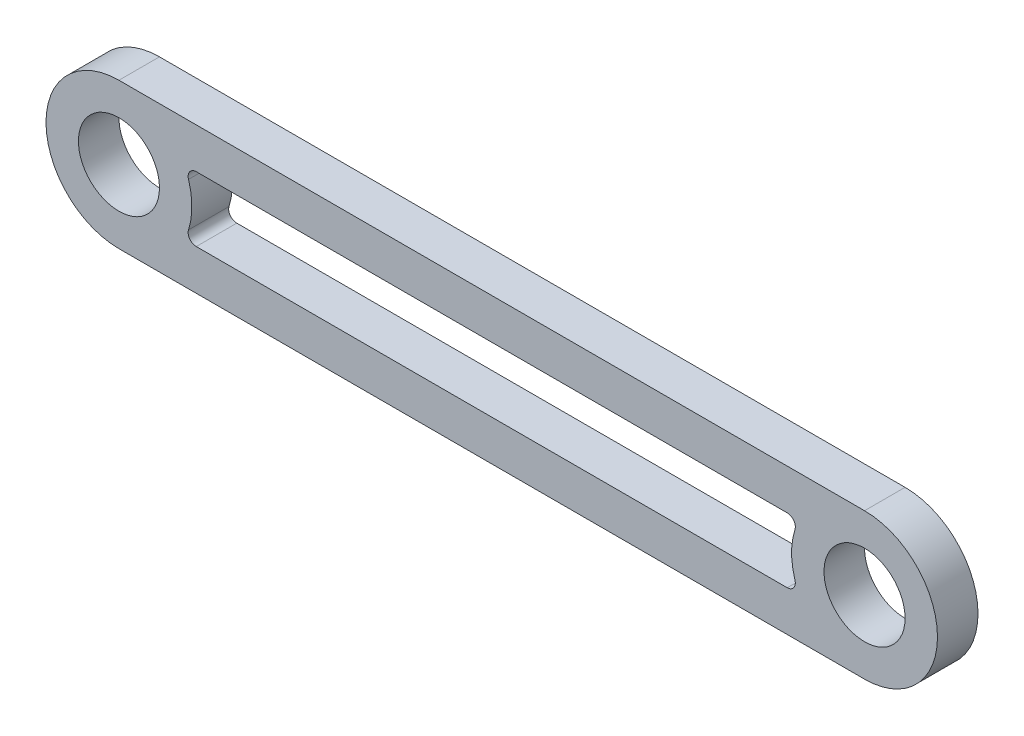
from build123d import *

# Parameters (mm, degrees)
SKETCH_1_R          = 5
EXTRUDE_1_DEPTH     = 5
CUT_EXTRUDE_1_DEPTH = 102.523396318


with BuildPart() as part:
    # 草图1 → 凸台-拉伸1 (new body)
    with BuildSketch(Plane.XY):
        with BuildLine():
            Line((0, 9), (92, 9))
            ThreePointArc((92, 9), (101, 0), (92, -9))
            Line((92, -9), (0, -9))
            ThreePointArc((0, -9), (-9, 0), (0, 9))
        make_face()
        Circle(SKETCH_1_R, mode=Mode.SUBTRACT)
        with Locations((92, 0)):
            Circle(SKETCH_1_R, mode=Mode.SUBTRACT)
    extrude(amount=EXTRUDE_1_DEPTH)

    # 草图2 → 切除-拉伸1 (cut, through all)
    with BuildSketch(Plane.XY.offset(5)):
        with BuildLine():
            Line((9.539392014, 4), (82.460607986, 4))
            ThreePointArc((82.460607986, 4), (83.266833761, 3.591607978), (83.414547187, 2.7))
            ThreePointArc((83.414547187, 2.7), (83, 0), (83.414547187, -2.7))
            ThreePointArc((83.414547187, -2.7), (83.266833761, -3.591607978), (82.460607986, -4))
            Line((82.460607986, -4), (9.539392014, -4))
            ThreePointArc((9.539392014, -4), (8.733166239, -3.591607978), (8.585452813, -2.7))
            ThreePointArc((8.585452813, -2.7), (9, 0), (8.585452813, 2.7))
            ThreePointArc((8.585452813, 2.7), (8.733166239, 3.591607978), (9.539392014, 4))
        make_face()
    extrude(amount=-CUT_EXTRUDE_1_DEPTH, mode=Mode.SUBTRACT)


solid = part.part
